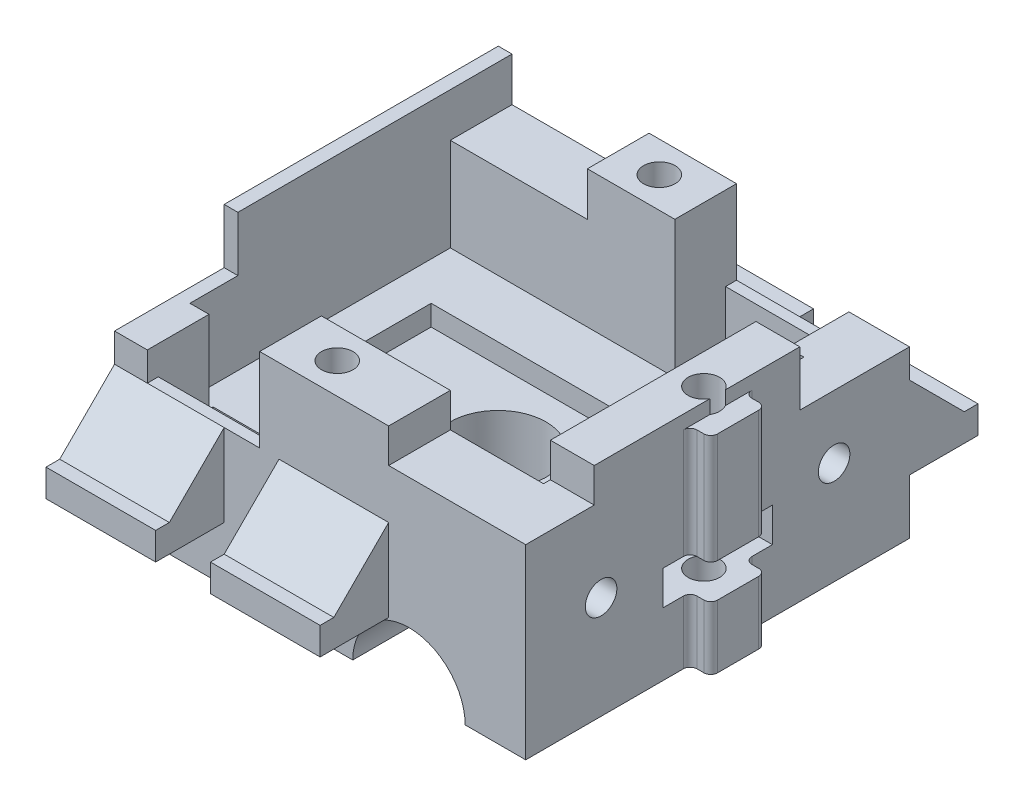
from build123d import *

# Parameters (mm, degrees)
SKETCH1_W           = 28
SKETCH1_H           = 16.1
BOSS_EXTRUDE1_DEPTH = 30
SKETCH2_W           = 10
SKETCH2_H           = 2.5
CUT_EXTRUDE1_DEPTH  = 5
SKETCH3_W           = 10
SKETCH3_H           = 4
CUT_EXTRUDE2_DEPTH  = 8
SKETCH4_W           = 10
SKETCH4_H           = 3.2
CUT_EXTRUDE3_DEPTH  = 8
SKETCH5_W           = 11
SKETCH5_H           = 4
CUT_EXTRUDE4_DEPTH  = 8
SKETCH6_W           = 20
SKETCH6_H           = 2
BOSS_EXTRUDE2_DEPTH = 5
CHAMFER1_SIZE       = 4
SKETCH7_W           = 20
SKETCH7_H           = 2
BOSS_EXTRUDE3_DEPTH = 5
CHAMFER2_SIZE       = 4
SKETCH9_W           = 25.8
SKETCH9_H           = 19
CUT_EXTRUDE6_DEPTH  = 10
SKETCH13_R          = 4.1
CUT_EXTRUDE10_DEPTH = 27.2
SKETCH14_R          = 4.1
CUT_EXTRUDE11_DEPTH = 27.2
SKETCH15_W          = 8.2
SKETCH15_H          = 4
CUT_EXTRUDE12_DEPTH = 27.2
SKETCH16_W          = 0.59230819
SKETCH16_H          = 0.8
SKETCH16_W_2        = 1.617695922
CUT_EXTRUDE13_DEPTH = 4
SKETCH17_W          = 1.5
SKETCH17_H          = 4
BOSS_EXTRUDE4_DEPTH = 16.1
FILLET1_R           = 0.5
SKETCH18_R          = 3.5
CUT_EXTRUDE14_DEPTH = 6.1
SKETCH19_W          = 8
SKETCH19_H          = 1
CUT_EXTRUDE15_DEPTH = 10
SKETCH20_W          = 20.5
SKETCH20_H          = 10.6
CUT_EXTRUDE16_DEPTH = 1.5
SKETCH21_W          = 5.7
SKETCH21_H          = 8
CUT_EXTRUDE17_DEPTH = 1.5
SKETCH22_W          = 8
SKETCH22_H          = 2.5
CUT_EXTRUDE18_DEPTH = 1.5
SKETCH23_R          = 1.15
CUT_EXTRUDE19_DEPTH = 75.620049118
SKETCH24_W          = 8.2
SKETCH24_H          = 0.8
CUT_EXTRUDE20_DEPTH = 2.1
CUT_EXTRUDE21_REACH = 75.421
SKETCH25_W          = 7.929527271
SKETCH25_H          = 1
CUT_EXTRUDE22_START = -5
SKETCH26_W          = 4
SKETCH26_H          = 6
CUT_EXTRUDE22_DEPTH = 5
CUT_EXTRUDE23_START = -5
SKETCH27_W          = 4
SKETCH27_H          = 6
CUT_EXTRUDE23_DEPTH = 5
SKETCH28_R          = 1.15
CUT_EXTRUDE24_DEPTH = 3.2


with BuildPart() as part:
    # Sketch1 → Boss-Extrude1 (new body)
    with BuildSketch(Plane(origin=(0, 0, 0), x_dir=(0, 0, -1), z_dir=(1, 0, 0))):
        with Locations((-46.701535197, -0.990821865)):
            Rectangle(SKETCH1_W, SKETCH1_H)
    extrude(amount=BOSS_EXTRUDE1_DEPTH)

    # Sketch2 → Cut-Extrude1 (cut)
    with BuildSketch(Plane.XY.offset(60.701535197)):
        with Locations((25, 5.809178135)):
            Rectangle(SKETCH2_W, SKETCH2_H)
    extrude(amount=-CUT_EXTRUDE1_DEPTH, mode=Mode.SUBTRACT)

    # Sketch3 → Cut-Extrude2 (cut)
    with BuildSketch(Plane.XY.offset(60.701535197)):
        with Locations((5, 5.059178135)):
            Rectangle(SKETCH3_W, SKETCH3_H)
    extrude(amount=-CUT_EXTRUDE2_DEPTH, mode=Mode.SUBTRACT)

    # Sketch4 → Cut-Extrude3 (cut)
    with BuildSketch(Plane(origin=(0, 0, 32.701535197), x_dir=(-1, 0, 0), z_dir=(0, 0, -1))):
        with Locations((-6, 5.459178135)):
            Rectangle(SKETCH4_W, SKETCH4_H)
    extrude(amount=-CUT_EXTRUDE3_DEPTH, mode=Mode.SUBTRACT)

    # Sketch5 → Cut-Extrude4 (cut)
    with BuildSketch(Plane(origin=(0, 0, 32.701535197), x_dir=(-1, 0, 0), z_dir=(0, 0, -1))):
        with Locations((-24.5, 5.059178135)):
            Rectangle(SKETCH5_W, SKETCH5_H)
    extrude(amount=-CUT_EXTRUDE4_DEPTH, mode=Mode.SUBTRACT)

    # Sketch6 → Boss-Extrude2 (add)
    with BuildSketch(Plane(origin=(0, 0, 32.701535197), x_dir=(-1, 0, 0), z_dir=(0, 0, -1))):
        with Locations((-20, -4.040821865)):
            Rectangle(SKETCH6_W, SKETCH6_H)
    extrude(amount=BOSS_EXTRUDE2_DEPTH)

    # Chamfer1
    chamfer1_edges = [part.edges().sort_by_distance(p)[0] for p in [
        (20, -3.040821865, 32.701535197),
    ]]
    chamfer(chamfer1_edges, length=CHAMFER1_SIZE)

    # Sketch7 → Boss-Extrude3 (add)
    with BuildSketch(Plane.XY.offset(60.701535197)):
        with Locations((10, -4.040821865)):
            Rectangle(SKETCH7_W, SKETCH7_H)
    extrude(amount=BOSS_EXTRUDE3_DEPTH)

    # Chamfer2
    chamfer2_edges = [part.edges().sort_by_distance(p)[0] for p in [
        (10, -3.040821865, 60.701535197),
    ]]
    chamfer(chamfer2_edges, length=CHAMFER2_SIZE)

    # Sketch9 → Cut-Extrude6 (cut)
    with BuildSketch(Plane(origin=(0, 7.059178135, 0), x_dir=(1, 0, 0), z_dir=(0, 1, 0))):
        with Locations((13.9, -46.701535197)):
            Rectangle(SKETCH9_W, SKETCH9_H)
    extrude(amount=-CUT_EXTRUDE6_DEPTH, mode=Mode.SUBTRACT)

    # Sketch13 → Cut-Extrude10 (cut)
    with BuildSketch(Plane.XY.offset(60.701535197)):
        with Locations((21.482304078, -9.040821865)):
            Circle(SKETCH13_R)
    extrude(amount=-CUT_EXTRUDE10_DEPTH, mode=Mode.SUBTRACT)

    # Sketch14 → Cut-Extrude11 (cut)
    with BuildSketch(Plane(origin=(0, 0, 32.701535197), x_dir=(-1, 0, 0), z_dir=(0, 0, -1))):
        with Locations((-6.49230819, -9.040821865)):
            Circle(SKETCH14_R)
    extrude(amount=-CUT_EXTRUDE11_DEPTH, mode=Mode.SUBTRACT)

    # Sketch15 → Cut-Extrude12 (cut)
    with BuildSketch(Plane.XZ.offset(9.040821865)):
        with Locations((6.49230819, 57.901535197)):
            Rectangle(SKETCH15_W, SKETCH15_H)
        with Locations((21.482304078, 35.501535197)):
            Rectangle(SKETCH15_W, SKETCH15_H)
    extrude(amount=-CUT_EXTRUDE12_DEPTH, mode=Mode.SUBTRACT)

    # Sketch16 → Cut-Extrude13 (cut)
    with BuildSketch(Plane(origin=(0, 7.059178135, 0), x_dir=(1, 0, 0), z_dir=(0, 1, 0))):
        with Locations((10.296154095, -60.301535197)):
            Rectangle(SKETCH16_W, SKETCH16_H)
        with Locations((18.191152039, -33.101535197)):
            Rectangle(SKETCH16_W_2, SKETCH16_H)
    extrude(amount=-CUT_EXTRUDE13_DEPTH, mode=Mode.SUBTRACT)

    # Sketch17 → Boss-Extrude4 (add)
    with BuildSketch(Plane.XZ.offset(9.040821865)):
        with Locations((30.75, 46.701535197)):
            Rectangle(SKETCH17_W, SKETCH17_H)
    extrude(amount=-BOSS_EXTRUDE4_DEPTH)

    # Fillet1
    fillet1_edges = [part.edges().sort_by_distance(p)[0] for p in [
        (30, -0.990821865, 44.701535197),
        (30, -0.990821865, 48.701535197),
        (31.5, -0.990821865, 48.701535197),
        (31.5, -0.990821865, 44.701535197),
    ]]
    fillet(fillet1_edges, radius=FILLET1_R)

    # Sketch18 → Cut-Extrude14 (cut)
    with BuildSketch(Plane.XZ.offset(9.040821865)):
        with Locations(Location((13.985, 46.701535197, 0), (0, 0, 194.224464848))):
            Circle(SKETCH18_R)
    extrude(amount=-CUT_EXTRUDE14_DEPTH, mode=Mode.SUBTRACT)

    # Sketch19 → Cut-Extrude15 (cut)
    with BuildSketch(Plane(origin=(31.5, 0, 0), x_dir=(0, 0, -1), z_dir=(1, 0, 0))):
        with Locations((-46.701535197, -2.440821865)):
            Rectangle(SKETCH19_W, SKETCH19_H)
    extrude(amount=-CUT_EXTRUDE15_DEPTH, mode=Mode.SUBTRACT)

    # Sketch20 → Cut-Extrude16 (cut)
    with BuildSketch(Plane(origin=(0, -2.940821865, 0), x_dir=(1, 0, 0), z_dir=(0, 1, 0))):
        with Locations((14.05, -46.701535197)):
            Rectangle(SKETCH20_W, SKETCH20_H)
    extrude(amount=-CUT_EXTRUDE16_DEPTH, mode=Mode.SUBTRACT)

    # Sketch21 → Cut-Extrude17 (cut)
    with BuildSketch(Plane(origin=(0, -2.940821865, 0), x_dir=(1, 0, 0), z_dir=(0, 1, 0))):
        with Locations((27.15, -46.701535197)):
            Rectangle(SKETCH21_W, SKETCH21_H)
    extrude(amount=-CUT_EXTRUDE17_DEPTH, mode=Mode.SUBTRACT)

    # Sketch22 → Cut-Extrude18 (cut)
    with BuildSketch(Plane(origin=(31.5, 0, 0), x_dir=(0, 0, -1), z_dir=(1, 0, 0))):
        with Locations((-46.701535197, -3.190821865)):
            Rectangle(SKETCH22_W, SKETCH22_H)
    extrude(amount=-CUT_EXTRUDE18_DEPTH, mode=Mode.SUBTRACT)

    # Sketch23 → Cut-Extrude19 (cut, through all)
    with BuildSketch(Plane(origin=(0, 7.059178135, 0), x_dir=(1, 0, 0), z_dir=(0, 1, 0))):
        with Locations(Location((29, -46.701535197, 0), (0, 0, 270))):
            Circle(SKETCH23_R)
        with Locations(Location((14, -34.951535197, 0), (0, 0, 270))):
            Circle(SKETCH23_R)
        with Locations(Location((14, -58.451535197, 0), (0, 0, 270))):
            Circle(SKETCH23_R)
    extrude(amount=-CUT_EXTRUDE19_DEPTH, mode=Mode.SUBTRACT)

    # Sketch24 → Cut-Extrude20 (cut)
    with BuildSketch(Plane(origin=(0, 3.059178135, 0), x_dir=(1, 0, 0), z_dir=(0, 1, 0))):
        with Locations((21.482304078, -33.101535197)):
            Rectangle(SKETCH24_W, SKETCH24_H)
        with Locations((6.49230819, -60.301535197)):
            Rectangle(SKETCH24_W, SKETCH24_H)
    extrude(amount=-CUT_EXTRUDE20_DEPTH, mode=Mode.SUBTRACT)

    # Cut-Extrude21: up to this face of the body (flat: up to its plane)
    cut_extrude21_end = Plane(part.part.faces().sort_by_distance((30, -1.445232759, 54.822020691))[0])
    # Sketch25 → Cut-Extrude21 (cut, up to the picked face)
    with BuildSketch(Plane(origin=(31.5, 0, 0), x_dir=(0, 0, -1), z_dir=(1, 0, 0)), mode=Mode.PRIVATE) as cut_extrude21_sk1:
        with Locations((-46.553400254, 6.559178135)):
            Rectangle(SKETCH25_W, SKETCH25_H)
    cut_extrude21_tool1 = split(extrude(cut_extrude21_sk1.sketch, amount=-CUT_EXTRUDE21_REACH, mode=Mode.PRIVATE), bisect_by=cut_extrude21_end, keep=Keep.BOTH, mode=Mode.PRIVATE)
    add(cut_extrude21_tool1.solids().sort_by(Axis((31.5, 6.559178, 46.5534), (-1, 0, 0)))[0], mode=Mode.SUBTRACT)

    # Sketch26 → Cut-Extrude22 (cut)
    with BuildSketch(Plane.XY.offset(65.701535197).offset(CUT_EXTRUDE22_START)):
        with Locations((10, -2.040821865)):
            Rectangle(SKETCH26_W, SKETCH26_H)
    extrude(amount=CUT_EXTRUDE22_DEPTH, mode=Mode.SUBTRACT)

    # Sketch27 → Cut-Extrude23 (cut)
    with BuildSketch(Plane(origin=(0, 0, 27.701535197), x_dir=(-1, 0, 0), z_dir=(0, 0, -1)).offset(CUT_EXTRUDE23_START)):
        with Locations((-20, -2.040821865)):
            Rectangle(SKETCH27_W, SKETCH27_H)
    extrude(amount=CUT_EXTRUDE23_DEPTH, mode=Mode.SUBTRACT)

    # Sketch28 → Cut-Extrude24 (cut)
    with BuildSketch(Plane(origin=(30, 0, 0), x_dir=(0, 0, -1), z_dir=(1, 0, 0))):
        with Locations((-55.201535197, -1.540821865)):
            Circle(SKETCH28_R)
        with Locations((-38.201535197, -1.540821865)):
            Circle(SKETCH28_R)
    extrude(amount=-CUT_EXTRUDE24_DEPTH, mode=Mode.SUBTRACT)


solid = part.part
